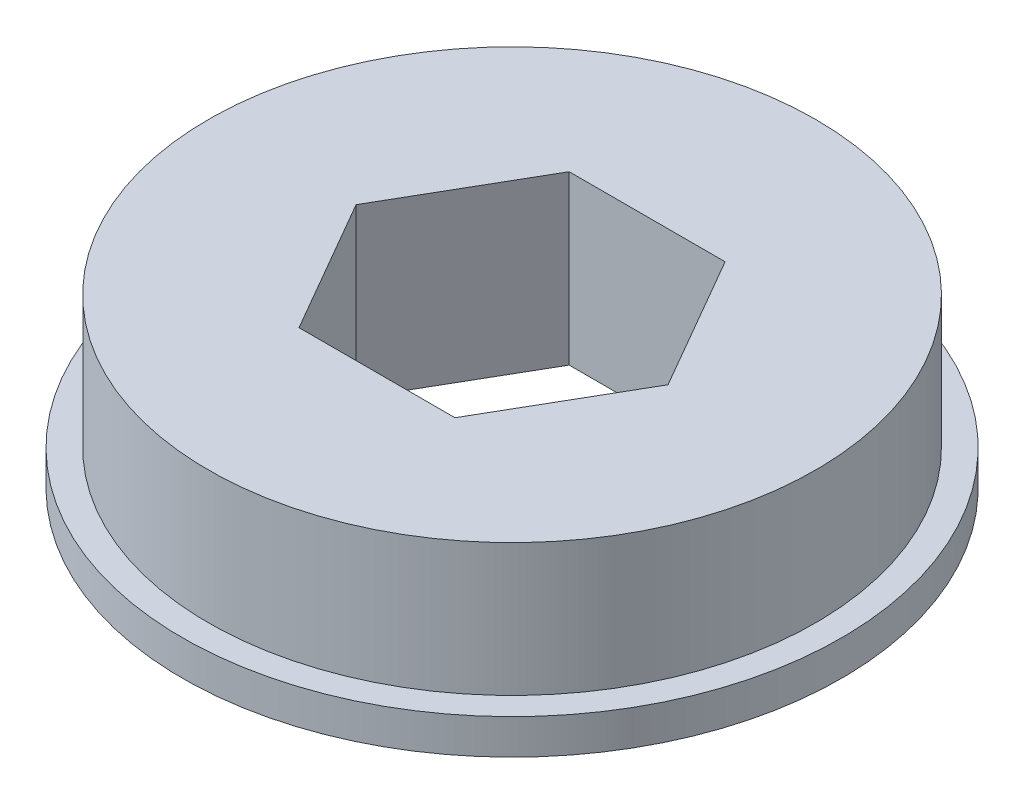
from build123d import *

# Parameters (mm, degrees)
CUT_EXTRUDE1_DEPTH = 24.28364121


with BuildPart() as part:
    # Sketch3 → Revolve1 (revolve)
    with BuildSketch(Plane(origin=(0, 0, 0), x_dir=(0, 0, -1), z_dir=(1, 0, 0))):
        Polygon((0, 7.874), (14.2748, 7.874), (14.2748, 1.651), (15.494, 1.651), (15.494, 0), (0, 0), align=None)
    revolve(axis=Axis((0, 0, 0), (0, 1, 0)))

    # Sketch4 → Cut-Extrude1 (cut, through all)
    with BuildSketch(Plane(origin=(0, 7.874, 0), x_dir=(1, 0, 0), z_dir=(0, 1, 0))):
        Polygon((-3.666174209, 6.35), (-7.332348419, 0), (-3.666174209, -6.35), (3.666174209, -6.35), (7.332348419, 0), (3.666174209, 6.35), align=None)
    extrude(amount=-CUT_EXTRUDE1_DEPTH, mode=Mode.SUBTRACT)


solid = part.part
